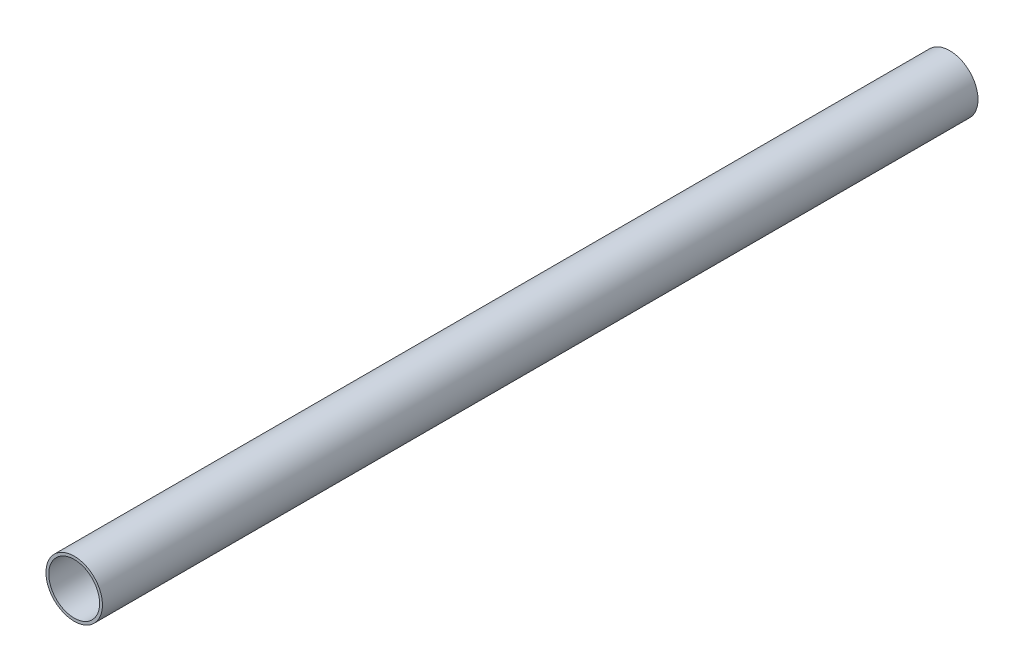
from build123d import *

# Parameters (mm, degrees)
SKETCH_1_R      = 10
SKETCH_1_R_2    = 9
EXTRUDE_1_DEPTH = 155


with BuildPart() as part:
    # 草图1 → 凸台-拉伸1 (new, symmetric)
    with BuildSketch(Plane.XY):
        Circle(SKETCH_1_R)
        Circle(SKETCH_1_R_2, mode=Mode.SUBTRACT)
    extrude(amount=EXTRUDE_1_DEPTH, both=True)


solid = part.part
